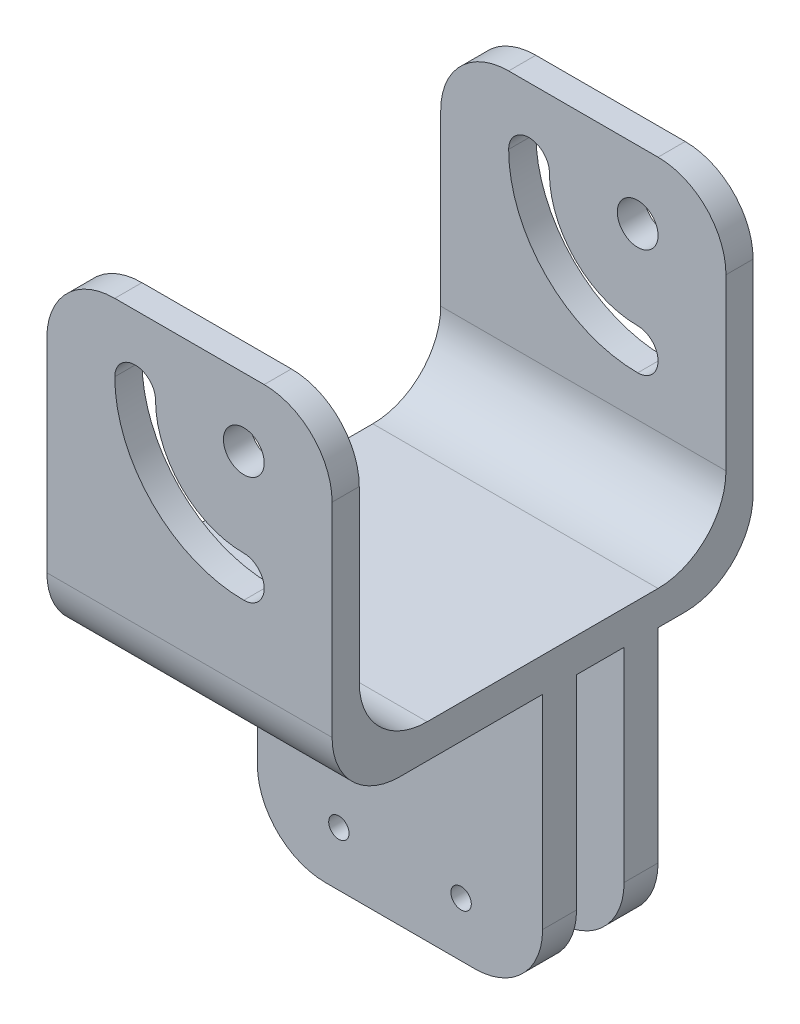
from build123d import *

# Parameters (mm, degrees)
ESBO_O1_W                = 42
ESBO_O1_H                = 50
ESBO_O1_R                = 3
RESSALTO_EXTRUS_O2_DEPTH = 62
ESBO_O3_W                = 42
ESBO_O3_H                = 54
CORTE_EXTRUS_O1_DEPTH    = 45
ESBO_O7_W                = 42
ESBO_O7_H                = 5
RESSALTO_EXTRUS_O3_DEPTH = 40
ESBO_O10_R               = 1.5
CORTE_EXTRUS_O2_DEPTH    = 82.043198357
FILETE1_R                = 10


with BuildPart() as part:
    # Esboço1 → Ressalto-extrusão2 (new body)
    with BuildSketch(Plane.XY):
        with Locations((21, 25)):
            Rectangle(ESBO_O1_W, ESBO_O1_H)
        with Locations((29, 40)):
            Circle(ESBO_O1_R, mode=Mode.SUBTRACT)
        with BuildLine():
            ThreePointArc((10, 40), (15.564971157, 26.564971157), (29, 21))
            ThreePointArc((29, 21), (32, 24), (29, 27))
            ThreePointArc((29, 27), (19.807611845, 30.807611845), (16, 40))
            ThreePointArc((16, 40), (13, 43), (10, 40))
        make_face(mode=Mode.SUBTRACT)
    extrude(amount=RESSALTO_EXTRUS_O2_DEPTH)

    # Esboço3 → Corte-extrusão1 (cut)
    with BuildSketch(Plane(origin=(0, 50, 0), x_dir=(1, 0, 0), z_dir=(0, 1, 0))):
        with Locations((21, -31)):
            Rectangle(ESBO_O3_W, ESBO_O3_H)
    extrude(amount=-CORTE_EXTRUS_O1_DEPTH, mode=Mode.SUBTRACT)

    # Esboço7 → Ressalto-extrusão3 (add)
    with BuildSketch(Plane.XZ):
        with Locations((21, 16.5)):
            Rectangle(ESBO_O7_W, ESBO_O7_H)
        with Locations((21, 28.5)):
            Rectangle(ESBO_O7_W, ESBO_O7_H)
    extrude(amount=RESSALTO_EXTRUS_O3_DEPTH)

    # Esboço10 → Corte-extrusão2 (cut, through all)
    with BuildSketch(Plane(origin=(0, 0, 14), x_dir=(-1, 0, 0), z_dir=(0, 0, -1))):
        with Locations((-30, -32)):
            Circle(ESBO_O10_R)
        with Locations((-12, -32)):
            Circle(ESBO_O10_R)
    extrude(amount=-CORTE_EXTRUS_O2_DEPTH, mode=Mode.SUBTRACT)

    # Filete1
    filete1_edges = [part.edges().sort_by_distance(p)[0] for p in [
        (0, 50, 2),
        (42, 50, 2),
        (21, 5, 4),
        (21, 5, 58),
        (21, 0, 62),
        (21, 0, 0),
        (0, -40, 16.5),
        (42, -40, 16.5),
        (0, -40, 28.5),
        (42, -40, 28.5),
        (0, 50, 60),
        (42, 50, 60),
    ]]
    fillet(filete1_edges, radius=FILETE1_R)


solid = part.part
